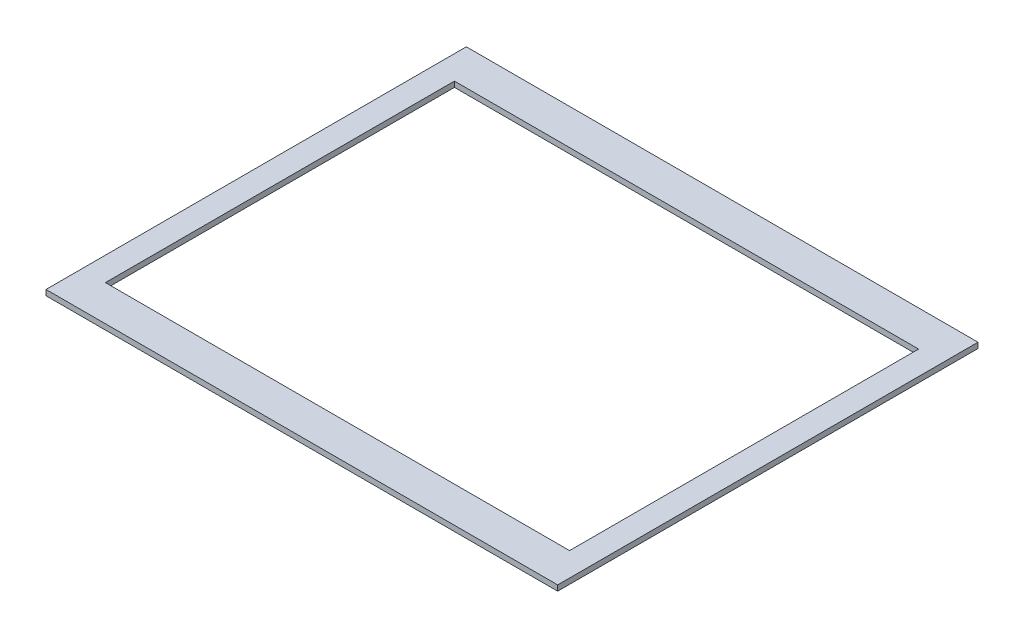
from build123d import *

# Parameters (mm, degrees)
SKETCH1_W           = 280
SKETCH1_H           = 230
SKETCH1_W_2         = 254
SKETCH1_H_2         = 191
BOSS_EXTRUDE1_DEPTH = 3


with BuildPart() as part:
    # Sketch1 → Boss-Extrude1 (new body)
    with BuildSketch(Plane(origin=(0, 0, 0), x_dir=(1, 0, 0), z_dir=(0, 1, 0))):
        with Locations((140, 115)):
            Rectangle(SKETCH1_W, SKETCH1_H)
        with Locations((140, 115)):
            Rectangle(SKETCH1_W_2, SKETCH1_H_2, mode=Mode.SUBTRACT)
    extrude(amount=BOSS_EXTRUDE1_DEPTH)


solid = part.part
